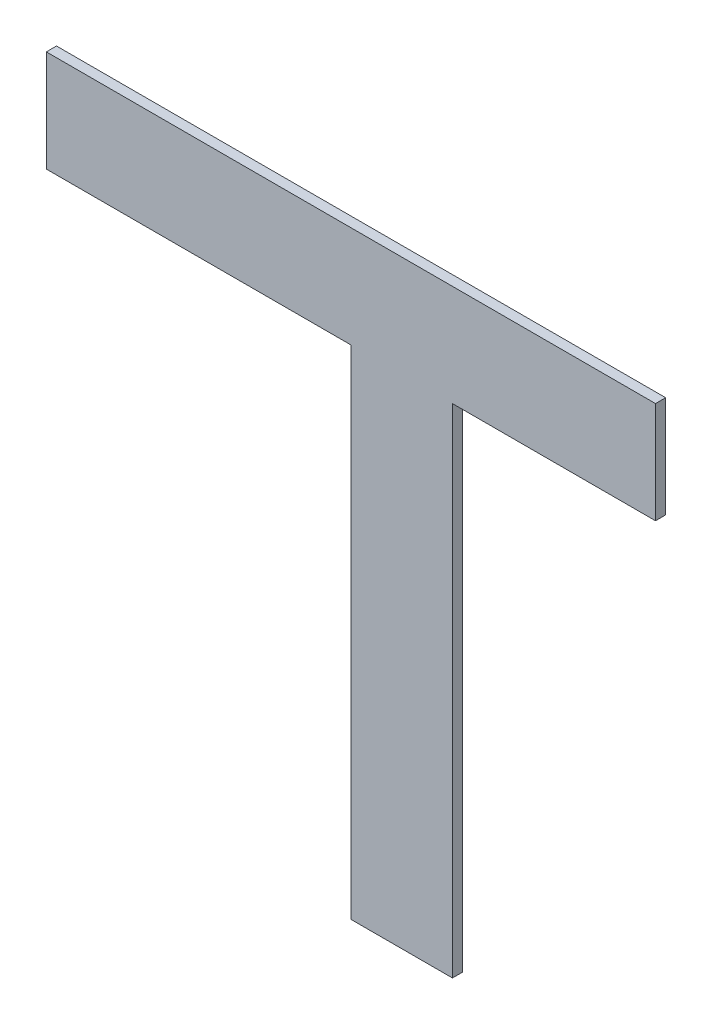
from build123d import *

# Parameters (mm, degrees)
SKETCH1_W           = 25.4
SKETCH1_H           = 124.46
BOSS_EXTRUDE1_DEPTH = 1.27


with BuildPart() as part:
    # Sketch1 → Boss-Extrude1 (new, symmetric)
    with BuildSketch(Plane.XY):
        with Locations((-12.7, -62.23)):
            Rectangle(SKETCH1_W, SKETCH1_H)
        Polygon((50.8, 25.4), (-101.6, 25.4), (-101.6, 0), (-25.4, 0), (0, 0), (50.8, 0), align=None)
    extrude(amount=BOSS_EXTRUDE1_DEPTH, both=True)


solid = part.part
